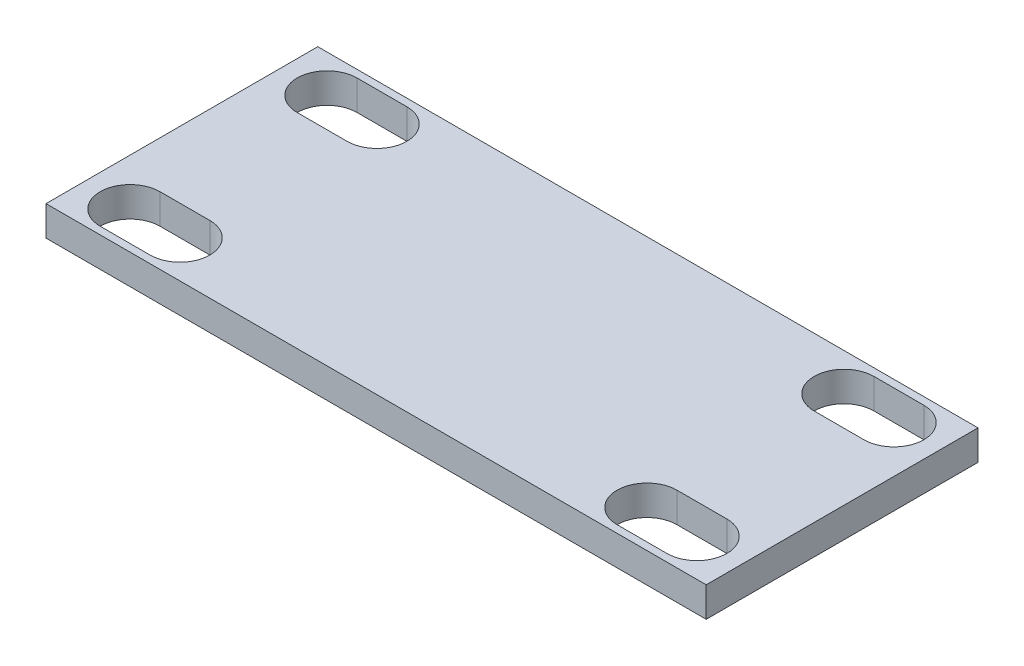
from build123d import *

# Parameters (mm, degrees)
SKETCH_1_W      = 66.19
SKETCH_1_H      = 27.25
EXTRUDE_1_DEPTH = 3


with BuildPart() as part:
    # 草图1 → 凸台-拉伸1 (new body)
    with BuildSketch(Plane(origin=(0, 0, 0), x_dir=(1, 0, 0), z_dir=(0, 1, 0))):
        Rectangle(SKETCH_1_W, SKETCH_1_H)
        with BuildLine():
            Line((-28.41294438, 12.875), (-23.41294438, 12.875))
            ThreePointArc((-23.41294438, 12.875), (-20.41294438, 9.875), (-23.41294438, 6.875))
            Line((-23.41294438, 6.875), (-28.41294438, 6.875))
            ThreePointArc((-28.41294438, 6.875), (-31.41294438, 9.875), (-28.41294438, 12.875))
        make_face(mode=Mode.SUBTRACT)
        with BuildLine():
            Line((28.41294438, 12.875), (23.41294438, 12.875))
            ThreePointArc((23.41294438, 12.875), (20.41294438, 9.875), (23.41294438, 6.875))
            Line((23.41294438, 6.875), (28.41294438, 6.875))
            ThreePointArc((28.41294438, 6.875), (31.41294438, 9.875), (28.41294438, 12.875))
        make_face(mode=Mode.SUBTRACT)
        with BuildLine():
            Line((-28.41294438, -12.875), (-23.41294438, -12.875))
            ThreePointArc((-23.41294438, -12.875), (-20.41294438, -9.875), (-23.41294438, -6.875))
            Line((-23.41294438, -6.875), (-28.41294438, -6.875))
            ThreePointArc((-28.41294438, -6.875), (-31.41294438, -9.875), (-28.41294438, -12.875))
        make_face(mode=Mode.SUBTRACT)
        with BuildLine():
            Line((28.41294438, -12.875), (23.41294438, -12.875))
            ThreePointArc((23.41294438, -12.875), (20.41294438, -9.875), (23.41294438, -6.875))
            Line((23.41294438, -6.875), (28.41294438, -6.875))
            ThreePointArc((28.41294438, -6.875), (31.41294438, -9.875), (28.41294438, -12.875))
        make_face(mode=Mode.SUBTRACT)
    extrude(amount=EXTRUDE_1_DEPTH)


solid = part.part
